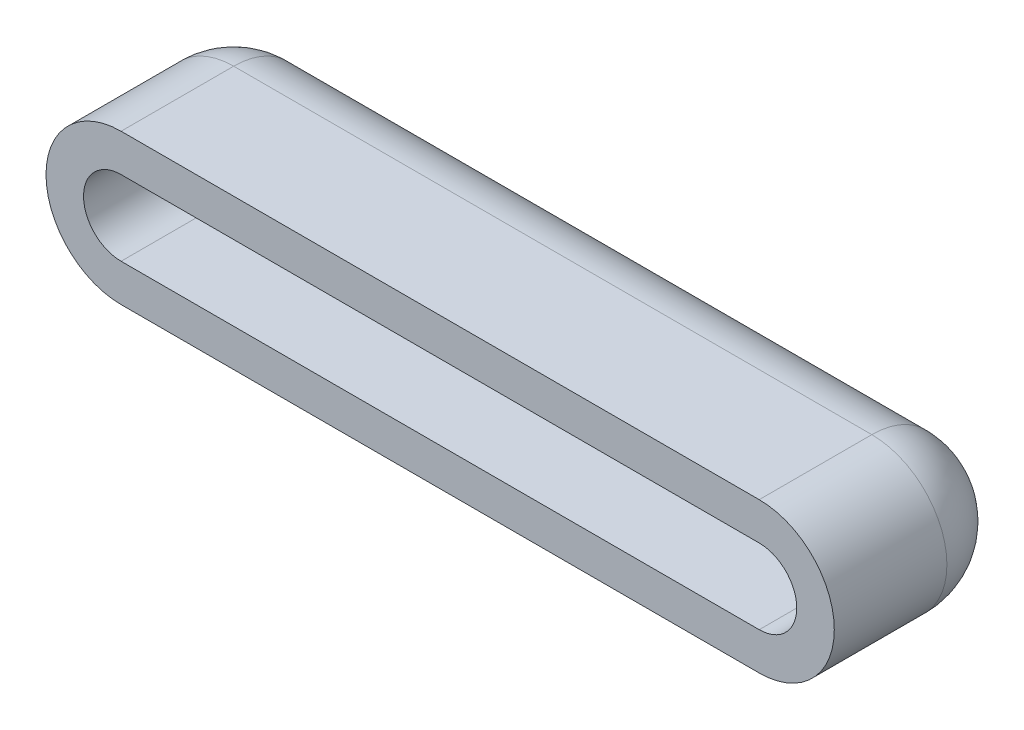
from build123d import *

# Parameters (mm, degrees)
BOSS_EXTRU_1_DEPTH = 10
COQUE1_T           = -2
CONG_1_R           = 4


with BuildPart() as part:
    # Esquisse1 → Boss.-Extru.1 (new body)
    with BuildSketch(Plane.XY):
        with BuildLine():
            Line((0, 4), (34, 4))
            ThreePointArc((34, 4), (38, 0), (34, -4))
            Line((34, -4), (0, -4))
            ThreePointArc((0, -4), (-4, 0), (0, 4))
        make_face()
    extrude(amount=BOSS_EXTRU_1_DEPTH)

    # Coque1
    coque1_openings = [part.faces().sort_by_distance(p)[0] for p in [
        (17, 0, 10),
    ]]
    offset(amount=COQUE1_T, openings=coque1_openings, kind=Kind.INTERSECTION)

    # Congé1
    cong_1_edges = [part.edges().sort_by_distance(p)[0] for p in [
        (38, 0, 0),
        (17, -4, 0),
        (-4, 0, 0),
        (17, 4, 0),
    ]]
    fillet(cong_1_edges, radius=CONG_1_R)


solid = part.part
